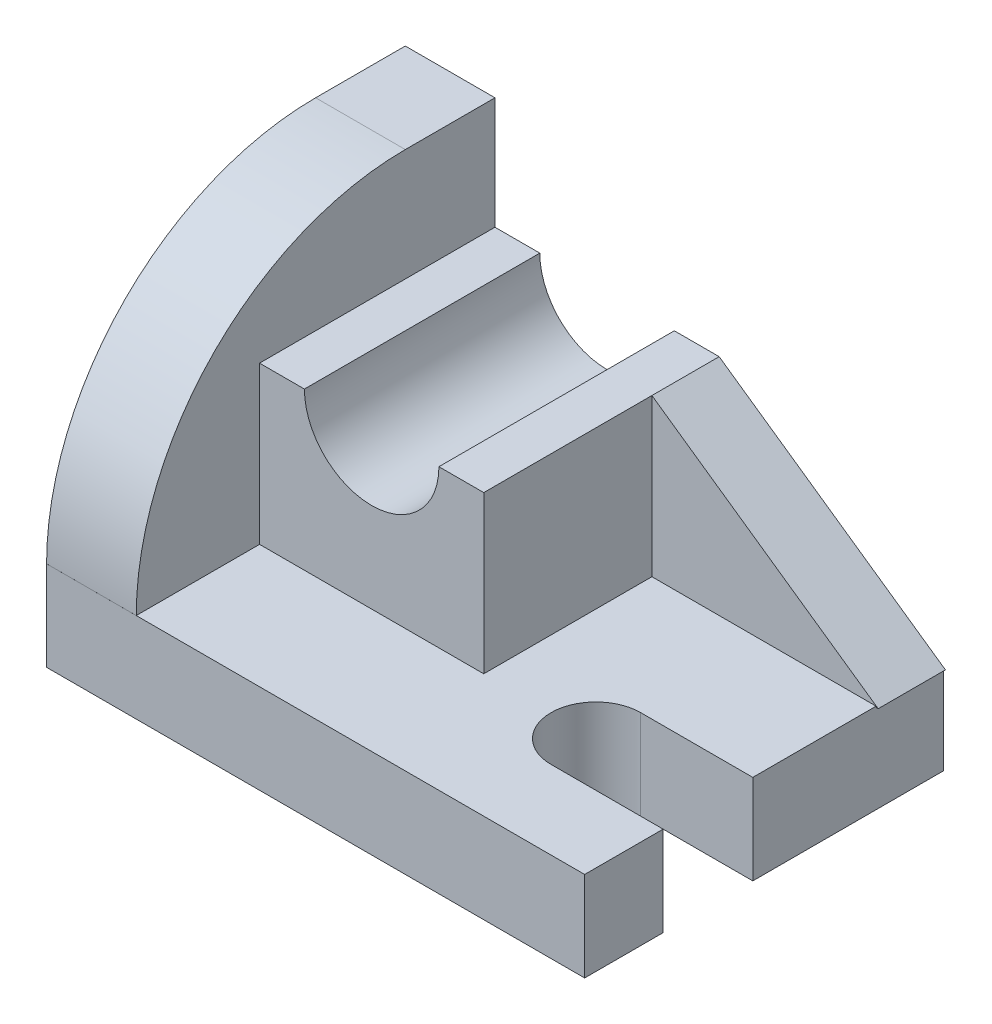
from build123d import *

# Parameters (mm, degrees)
SKETCH1_W           = 96
SKETCH1_H           = 64
BOSS_EXTRUDE1_DEPTH = 16
CUT_EXTRUDE2_DEPTH  = 16
BOSS_EXTRUDE2_START = -22
BOSS_EXTRUDE2_DEPTH = 42
BOSS_EXTRUDE3_DEPTH = 16
BOSS_EXTRUDE4_DEPTH = 12


with BuildPart() as part:
    # Sketch1 → Boss-Extrude1 (new body)
    with BuildSketch(Plane(origin=(0, 0, 0), x_dir=(1, 0, 0), z_dir=(0, 1, 0))):
        Rectangle(SKETCH1_W, SKETCH1_H)
    extrude(amount=BOSS_EXTRUDE1_DEPTH)

    # Sketch2 → Cut-Extrude2 (cut)
    with BuildSketch(Plane(origin=(0, 16, 0), x_dir=(1, 0, 0), z_dir=(0, 1, 0))):
        with BuildLine():
            Line((48, -18), (28, -18))
            ThreePointArc((28, -18), (20, -10), (28, -2))
            Line((28, -2), (48, -2))
            ThreePointArc((48, -2), (56, -10), (48, -18))
        make_face()
    extrude(amount=-CUT_EXTRUDE2_DEPTH, mode=Mode.SUBTRACT)

    # Sketch3 → Boss-Extrude2 (add)
    with BuildSketch(Plane.XY.offset(32).offset(BOSS_EXTRUDE2_START)):
        with BuildLine():
            Line((-32, 44), (-32, 16))
            Line((-32, 16), (8, 16))
            Line((8, 16), (8, 44))
            Line((8, 44), (0, 44))
            ThreePointArc((0, 44), (-12, 32), (-24, 44))
            Line((-24, 44), (-32, 44))
        make_face()
    extrude(amount=-BOSS_EXTRUDE2_DEPTH)

    # Sketch5 → Boss-Extrude3 (add)
    with BuildSketch(Plane.ZY.offset(48)):
        with BuildLine():
            Line((-32, 0), (31.997051588, 0))
            Line((31.997051588, 0), (31.997051588, 16))
            ThreePointArc((31.997051588, 16), (17.938177085, 49.941125497), (-16.002948412, 64))
            Line((-16.002948412, 64), (-32, 64))
            Line((-32, 64), (-32, 0))
        make_face()
    extrude(amount=-BOSS_EXTRUDE3_DEPTH)

    # Sketch6 → Boss-Extrude4 (add)
    with BuildSketch(Plane(origin=(0, 0, -32), x_dir=(-1, 0, 0), z_dir=(0, 0, -1))):
        Polygon((-8, 44), (-48.368210029, 15.792048014), (-8, 16), align=None)
    extrude(amount=-BOSS_EXTRUDE4_DEPTH)


solid = part.part
